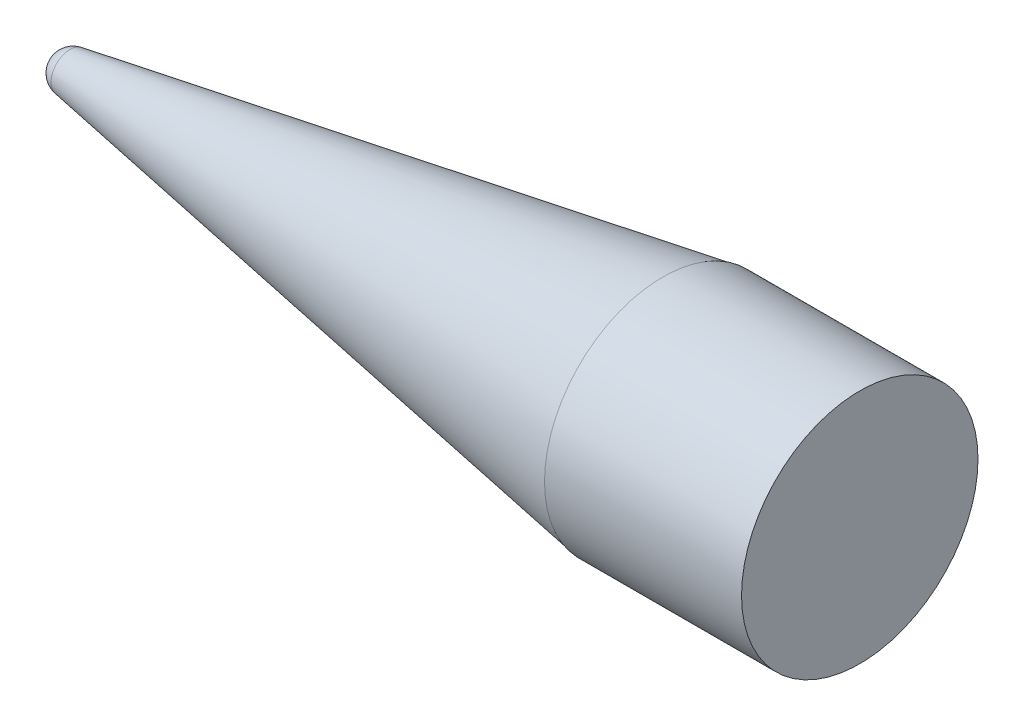
from build123d import *

# Parameters (mm, degrees)
SKETCH2_R           = 76.2
BOSS_EXTRUDE1_DEPTH = 127


with BuildPart() as part:
    # Sketch1 → Revolve3 (revolve)
    with BuildSketch(Plane(origin=(0, 0, 0), x_dir=(1, 0, 0), z_dir=(0, 1, 0))):
        with BuildLine():
            Line((457.256428843, 75.861426942), (457.256428843, 0))
            Line((457.256428843, 0), (64.89432739, 0))
            ThreePointArc((64.89432739, 0), (67.822631821, 7.98709736), (75.219645843, 12.188629775))
            Line((75.219645843, 12.188629775), (457.256428843, 75.861426942))
        make_face()
    revolve(axis=Axis((0, 0, 0), (1, 0, 0)))

    # Sketch2 → Boss-Extrude1 (add)
    with BuildSketch(Plane(origin=(457.256428843, 0, 0), x_dir=(0, 0, -1), z_dir=(1, 0, 0))):
        Circle(SKETCH2_R)
    extrude(amount=BOSS_EXTRUDE1_DEPTH)


solid = part.part
